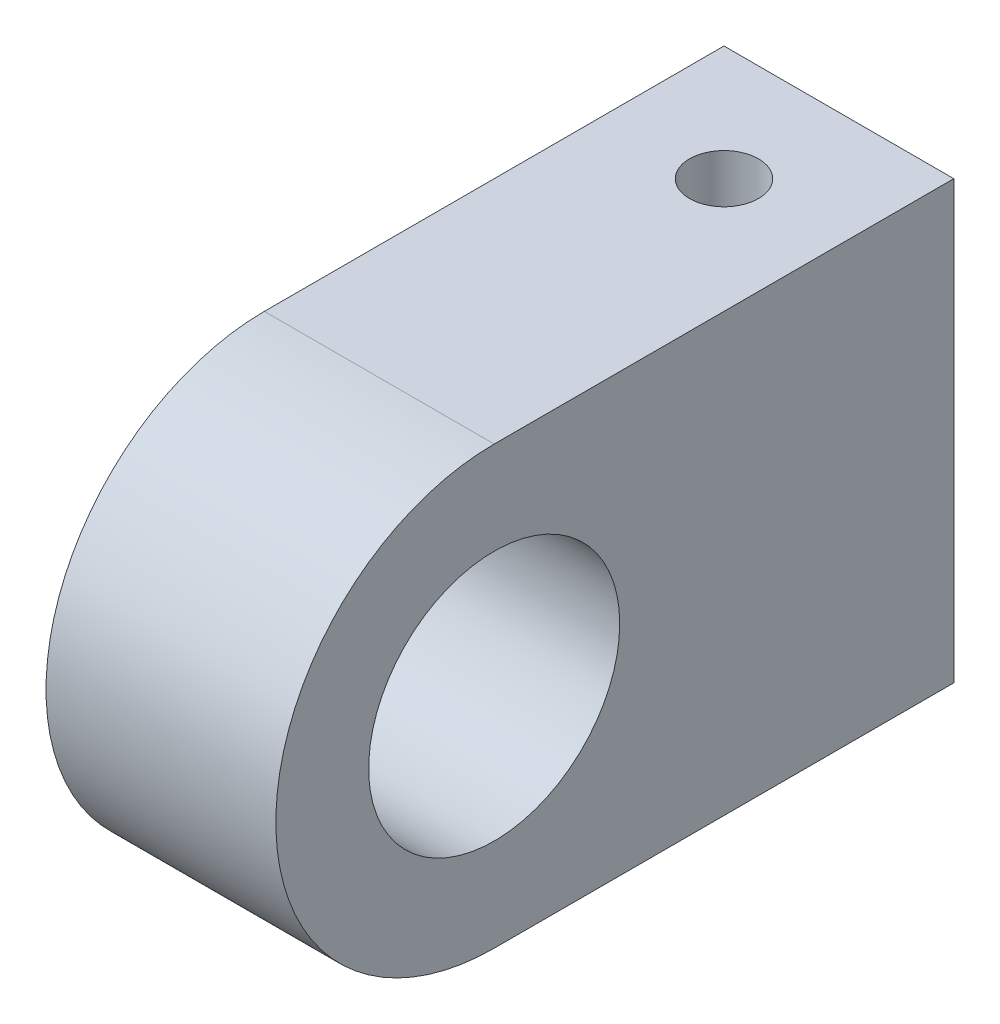
from build123d import *

# Parameters (mm, degrees)
SKETCH_1_R          = 5.462836395
EXTRUDE_1_DEPTH     = 10
SKETCH_2_R          = 1.5
CUT_EXTRUDE_1_DEPTH = 30.342801502


with BuildPart() as part:
    # 草图1 → 凸台-拉伸1 (new body)
    with BuildSketch(Plane(origin=(0, 0, 0), x_dir=(0, 0, -1), z_dir=(1, 0, 0))):
        with BuildLine():
            Line((0, 9.5), (20, 9.5))
            Line((20, 9.5), (20, -9.5))
            Line((20, -9.5), (0, -9.5))
            ThreePointArc((0, -9.5), (-6.717514421, -6.717514421), (-9.5, 0))
            ThreePointArc((-9.5, 0), (-6.717514421, 6.717514421), (0, 9.5))
        make_face()
        Circle(SKETCH_1_R, mode=Mode.SUBTRACT)
    extrude(amount=EXTRUDE_1_DEPTH)

    # 草图2 → 切除-拉伸1 (cut, through all)
    with BuildSketch(Plane(origin=(0, 9.5, 0), x_dir=(1, 0, 0), z_dir=(0, 1, 0))):
        with Locations(Location((5, 15, 0), (0, 0, 270))):
            Circle(SKETCH_2_R)
    extrude(amount=-CUT_EXTRUDE_1_DEPTH, mode=Mode.SUBTRACT)


solid = part.part
